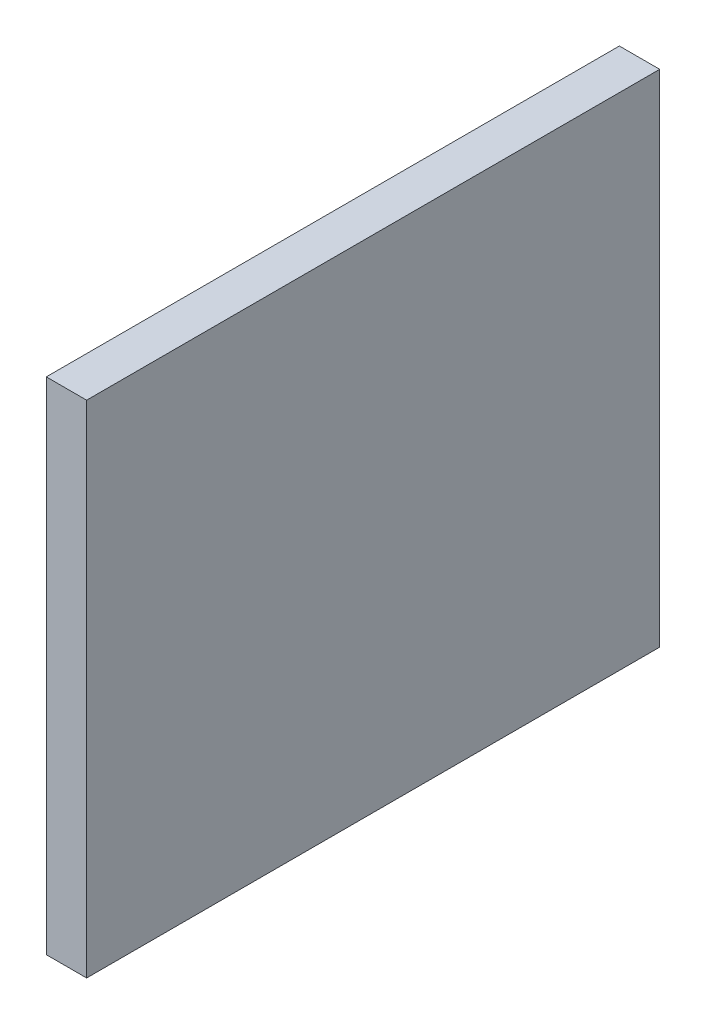
from build123d import *

# Parameters (mm, degrees)
CROQUIS1_W              = 10
CROQUIS1_H              = 124
SALIENTE_EXTRUIR3_DEPTH = 142


with BuildPart() as part:
    # Croquis1 → Saliente-Extruir3 (new body)
    with BuildSketch(Plane.XY):
        Rectangle(CROQUIS1_W, CROQUIS1_H)
    extrude(amount=SALIENTE_EXTRUIR3_DEPTH)


solid = part.part
